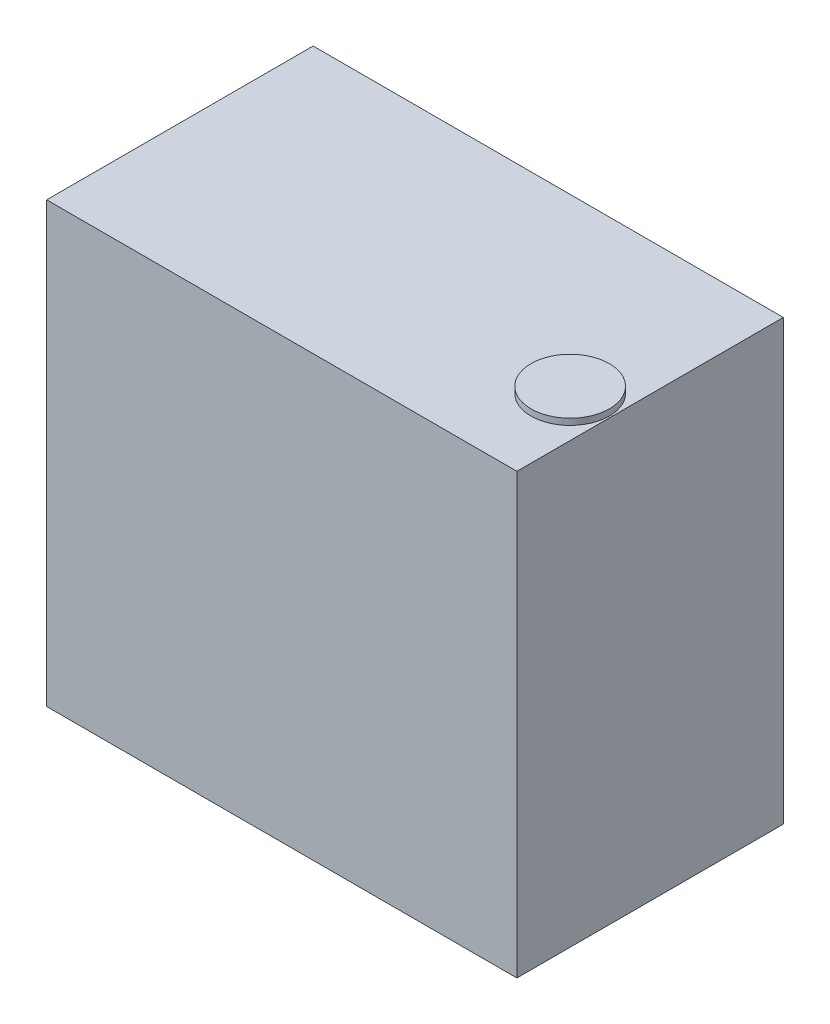
from build123d import *

# Parameters (mm, degrees)
SCHIZZO1_W                   = 150
SCHIZZO1_H                   = 140
ESTRUSIONE_ESTRUSIONE1_DEPTH = 85
SCHIZZO2_W                   = 20
SCHIZZO2_H                   = 15
SCHIZZO2_W_2                 = 30
SCHIZZO2_H_2                 = 11
ESTRUSIONE_ESTRUSIONE2_DEPTH = 4
SCHIZZO3_R                   = 1.5
TAGLIO_ESTRUSIONE1_DEPTH     = 10
SCHIZZO4_R                   = 12.5
ESTRUSIONE_ESTRUSIONE3_DEPTH = 2


with BuildPart() as part:
    # Schizzo1 → Estrusione-Estrusione1 (new body)
    with BuildSketch(Plane.XY):
        with Locations((75, 70)):
            Rectangle(SCHIZZO1_W, SCHIZZO1_H)
    extrude(amount=ESTRUSIONE_ESTRUSIONE1_DEPTH)

    # Schizzo2 → Estrusione-Estrusione2 (add)
    with BuildSketch(Plane.XZ):
        with Locations((120, 62.5)):
            Rectangle(SCHIZZO2_W, SCHIZZO2_H)
        Polygon((104, 35), (94, 24), (104, 24), align=None)
        Polygon((94, 24), (104, 13), (104, 24), align=None)
        with Locations((119, 29.5)):
            Rectangle(SCHIZZO2_W_2, SCHIZZO2_H_2)
        with Locations((119, 18.5)):
            Rectangle(SCHIZZO2_W_2, SCHIZZO2_H_2)
        Polygon((134, 35), (134, 24), (144, 24), align=None)
        Polygon((134, 24), (134, 13), (144, 24), align=None)
    extrude(amount=ESTRUSIONE_ESTRUSIONE2_DEPTH)

    # Schizzo3 → Taglio-Estrusione1 (cut)
    with BuildSketch(Plane.XZ):
        with Locations(Location((5, 80, 0), (0, 0, 270))):
            Circle(SCHIZZO3_R)
        with Locations(Location((5, 15, 0), (0, 0, 270))):
            Circle(SCHIZZO3_R)
        with Locations(Location((120, 6, 0), (0, 0, 270))):
            Circle(SCHIZZO3_R)
        with Locations(Location((143, 80, 0), (0, 0, 270))):
            Circle(SCHIZZO3_R)
    extrude(amount=-TAGLIO_ESTRUSIONE1_DEPTH, mode=Mode.SUBTRACT)

    # Schizzo4 → Estrusione-Estrusione3 (add)
    with BuildSketch(Plane(origin=(0, 140, 0), x_dir=(1, 0, 0), z_dir=(0, 1, 0))):
        with Locations(Location((137, -55, 0), (0, 0, 90))):
            Circle(SCHIZZO4_R)
    extrude(amount=ESTRUSIONE_ESTRUSIONE3_DEPTH)


solid = part.part
